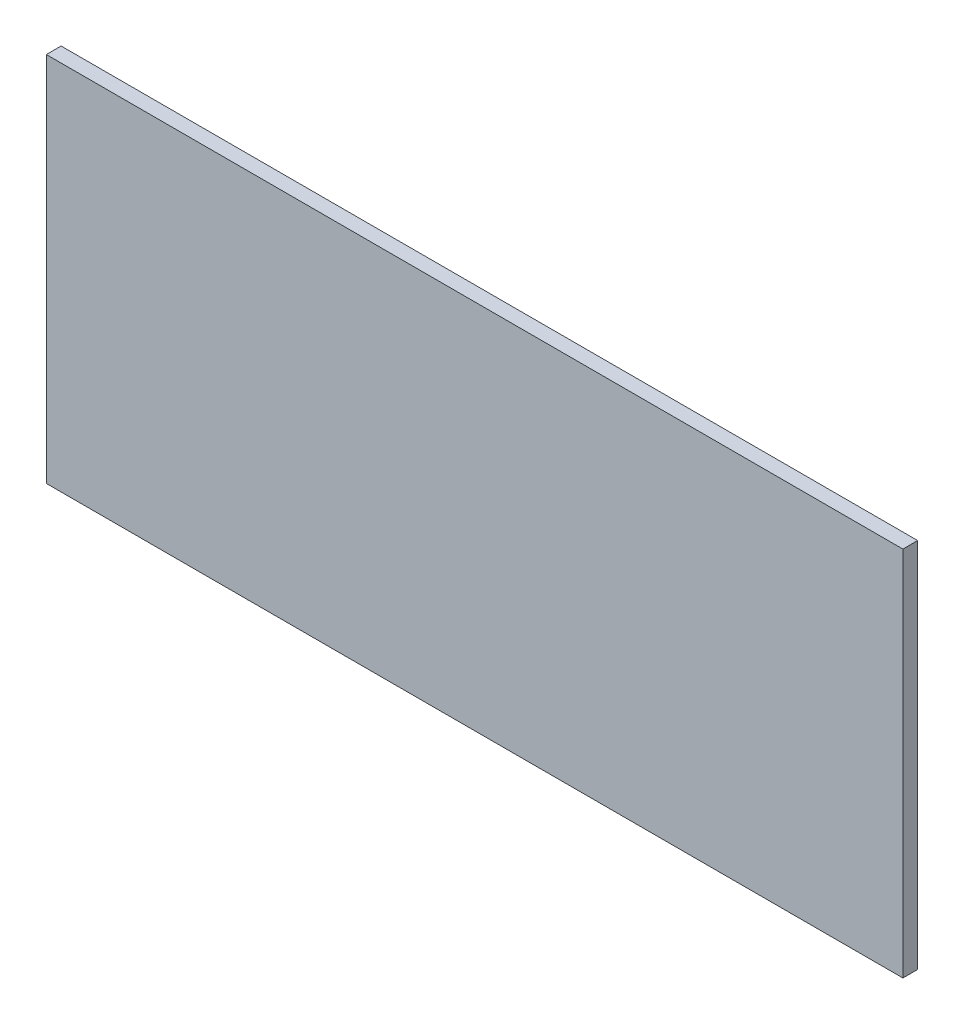
from build123d import *

# Parameters (mm, degrees)
ESQUISSE1_W        = 377
ESQUISSE1_H        = 163.5
BOSS_EXTRU_1_DEPTH = 6.5


with BuildPart() as part:
    # Esquisse1 → Boss.-Extru.1 (new body)
    with BuildSketch(Plane.XY):
        with Locations((-19.96713993, -31.419642857)):
            Rectangle(ESQUISSE1_W, ESQUISSE1_H)
    extrude(amount=BOSS_EXTRU_1_DEPTH)


solid = part.part
